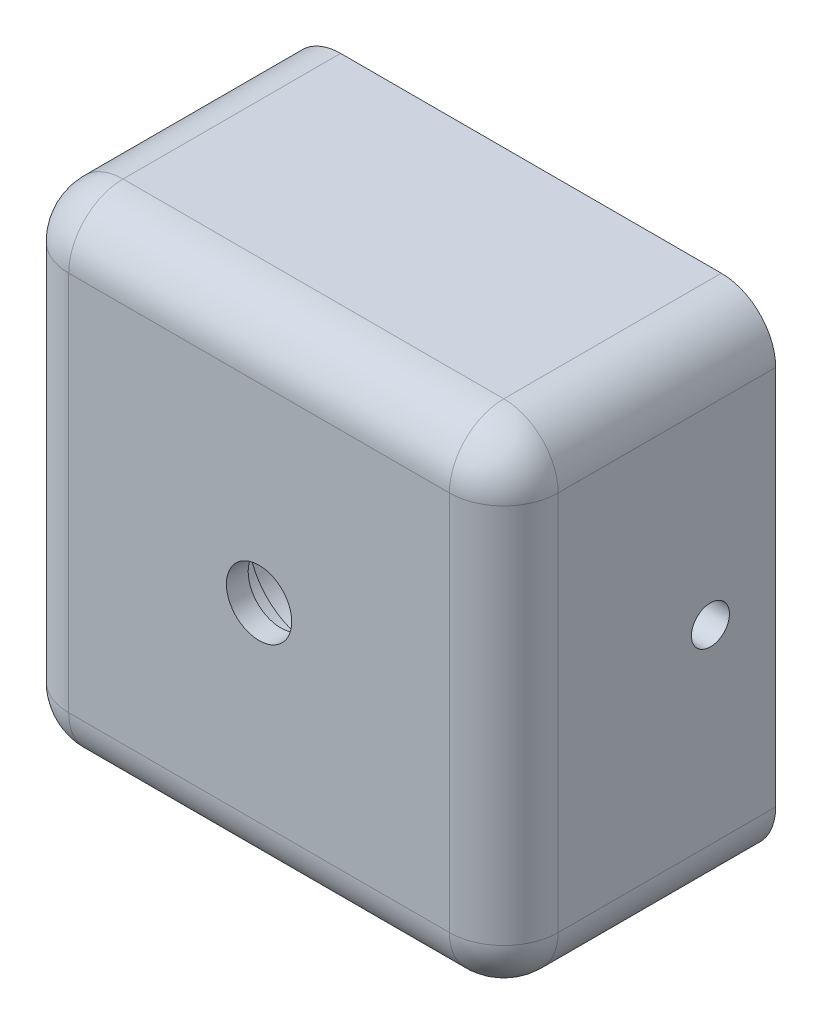
from build123d import *

# Parameters (mm, degrees)
CROQUIS1_W              = 45
CROQUIS1_H              = 45
SALIENTE_EXTRUIR1_DEPTH = 25
CROQUIS2_W              = 33
CROQUIS2_H              = 33
CORTAR_EXTRUIR1_DEPTH   = 20
CROQUIS3_R              = 6
CORTAR_EXTRUIR2_DEPTH   = 3
CROQUIS4_R              = 3
CORTAR_EXTRUIR3_DEPTH   = 6
CROQUIS5_R              = 1.75
CORTAR_EXTRUIR4_DEPTH   = 56
CORTAR_EXTRUIR5_DEPTH   = 2
CORTAR_EXTRUIR6_DEPTH   = 2
REDONDEO1_R             = 5
REDONDEO2_R             = 5


with BuildPart() as part:
    # Croquis1 → Saliente-Extruir1 (new body)
    with BuildSketch(Plane.XY):
        Rectangle(CROQUIS1_W, CROQUIS1_H)
    extrude(amount=SALIENTE_EXTRUIR1_DEPTH)

    # Croquis2 → Cortar-Extruir1 (cut)
    with BuildSketch(Plane(origin=(0, 0, 0), x_dir=(-1, 0, 0), z_dir=(0, 0, -1))):
        Rectangle(CROQUIS2_W, CROQUIS2_H)
    extrude(amount=-CORTAR_EXTRUIR1_DEPTH, mode=Mode.SUBTRACT)

    # Croquis3 → Cortar-Extruir2 (cut)
    with BuildSketch(Plane(origin=(0, 0, 20), x_dir=(-1, 0, 0), z_dir=(0, 0, -1))):
        Circle(CROQUIS3_R)
    extrude(amount=-CORTAR_EXTRUIR2_DEPTH, mode=Mode.SUBTRACT)

    # Croquis4 → Cortar-Extruir3 (cut)
    with BuildSketch(Plane(origin=(0, 0, 20), x_dir=(-1, 0, 0), z_dir=(0, 0, -1))):
        Circle(CROQUIS4_R)
    extrude(amount=-CORTAR_EXTRUIR3_DEPTH, mode=Mode.SUBTRACT)

    # Croquis5 → Cortar-Extruir4 (cut)
    with BuildSketch(Plane(origin=(22.5, 0, 0), x_dir=(0, 0, -1), z_dir=(1, 0, 0))):
        with Locations(Location((-6, 0, 0), (0, 0, 90))):
            Circle(CROQUIS5_R)
    extrude(amount=-CORTAR_EXTRUIR4_DEPTH, mode=Mode.SUBTRACT)

    # Croquis6 → Cortar-Extruir5 (cut)
    with BuildSketch(Plane.ZY.offset(-16.5)):
        Polygon((7.962990915, -3.4), (9.92598183, 0), (7.962990915, 3.4), (4.037009085, 3.4), (2.07401817, 0), (4.037009085, -3.4), align=None)
    extrude(amount=-CORTAR_EXTRUIR5_DEPTH, mode=Mode.SUBTRACT)

    # Croquis7 → Cortar-Extruir6 (cut)
    with BuildSketch(Plane(origin=(-16.5, 0, 0), x_dir=(0, 0, -1), z_dir=(1, 0, 0))):
        Polygon((-2.07401817, 0), (-4.037009085, 3.4), (-7.962990915, 3.4), (-9.92598183, 0), (-7.962990915, -3.4), (-4.037009085, -3.4), align=None)
    extrude(amount=-CORTAR_EXTRUIR6_DEPTH, mode=Mode.SUBTRACT)

    # Redondeo1
    redondeo1_edges = [part.edges().sort_by_distance(p)[0] for p in [
        (-16.5, 16.5, 10),
        (-16.5, -16.5, 10),
        (16.5, -16.5, 10),
        (16.5, 16.5, 10),
        (22.5, -22.5, 12.5),
        (-22.5, -22.5, 12.5),
        (-22.5, 22.5, 12.5),
        (22.5, 22.5, 12.5),
    ]]
    fillet(redondeo1_edges, radius=REDONDEO1_R)

    # Redondeo2
    redondeo2_edges = [part.edges().sort_by_distance(p)[0] for p in [
        (0, 22.5, 25),
        (22.5, 0, 25),
        (0, -22.5, 25),
        (21.035533906, 21.035533906, 25),
        (21.035533906, -21.035533906, 25),
        (-21.035533906, -21.035533906, 25),
        (-21.035533906, 21.035533906, 25),
        (-22.5, 0, 25),
    ]]
    fillet(redondeo2_edges, radius=REDONDEO2_R)


solid = part.part
